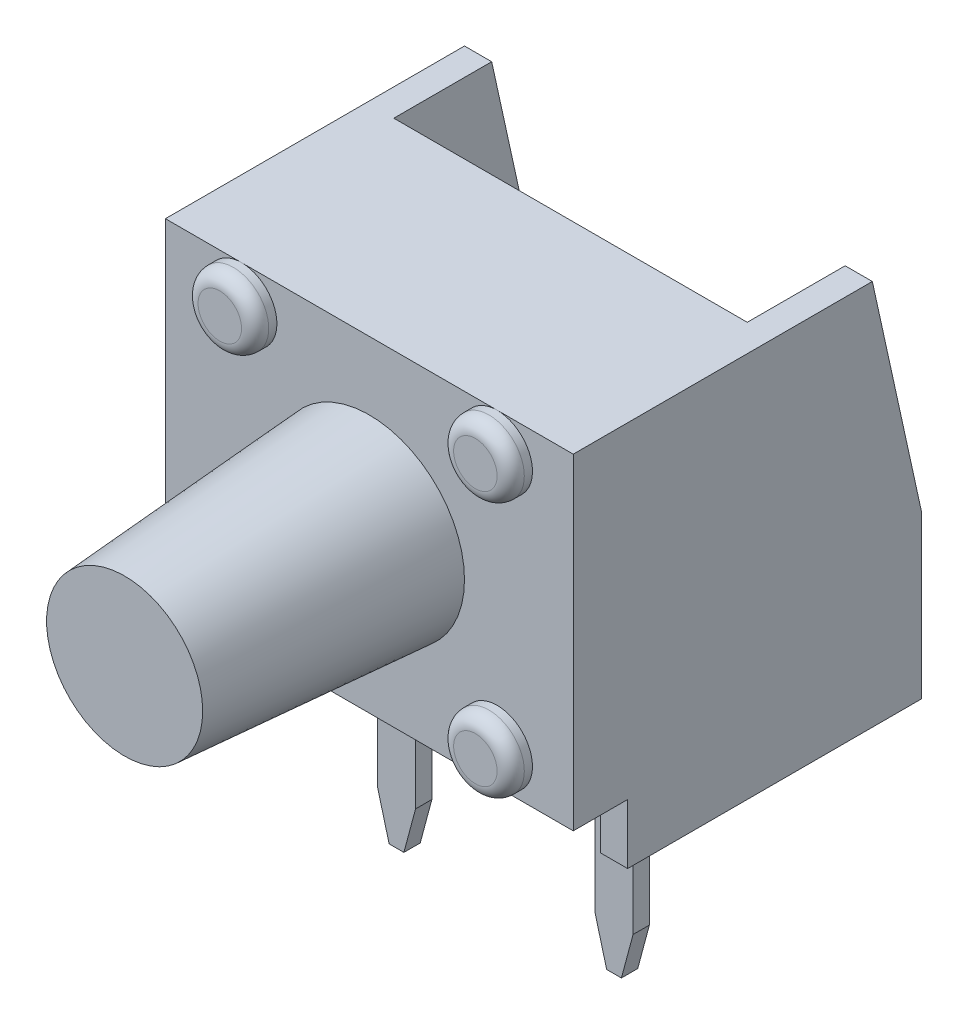
from build123d import *
from OCP.BRepFilletAPI import BRepFilletAPI_MakeChamfer

# Parameters (mm, degrees)
SKETCH1_W           = 7.5
SKETCH1_H           = 3.7
BOSS_EXTRUDE1_DEPTH = 6
SKETCH2_R           = 1.75
BOSS_EXTRUDE2_DEPTH = 4.5
BOSS_EXTRUDE2_TAPER = 4
SKETCH3_W           = 0.7
SKETCH3_H           = 0.3
BOSS_EXTRUDE3_DEPTH = 4.4
SKETCH4_W           = 0.5
SKETCH4_H           = 2.7
BOSS_EXTRUDE4_DEPTH = 1.1
BOSS_EXTRUDE5_DEPTH = 2.7
CUT_EXTRUDE1_DEPTH  = 12.541663658
SKETCH7_R           = 0.65
BOSS_EXTRUDE6_DEPTH = 0.4
FILLET1_R           = 0.25
CHAMFER1_SIZE       = 0.8
CHAMFER1_SIZE2      = 0.214359354


with BuildPart() as part:
    # Sketch1 → Boss-Extrude1 (new body)
    with BuildSketch(Plane(origin=(0, 0, 0), x_dir=(1, 0, 0), z_dir=(0, 1, 0))):
        with Locations((3.75, 1.85)):
            Rectangle(SKETCH1_W, SKETCH1_H)
    extrude(amount=BOSS_EXTRUDE1_DEPTH)

    # Sketch2 → Boss-Extrude2 (add)
    with BuildSketch(Plane.XY):
        with Locations((3.75, 3)):
            Circle(SKETCH2_R)
    extrude(amount=BOSS_EXTRUDE2_DEPTH, taper=BOSS_EXTRUDE2_TAPER)

    # Sketch3 → Boss-Extrude3 (add)
    with BuildSketch(Plane.XZ):
        with Locations((1.75, -2.65)):
            Rectangle(SKETCH3_W, SKETCH3_H)
        with Locations((5.75, -2.65)):
            Rectangle(SKETCH3_W, SKETCH3_H)
    extrude(amount=BOSS_EXTRUDE3_DEPTH)

    # Sketch4 → Boss-Extrude4 (add)
    with BuildSketch(Plane.XZ):
        with Locations((0.25, -2.35)):
            Rectangle(SKETCH4_W, SKETCH4_H)
        with Locations((7.25, -2.35)):
            Rectangle(SKETCH4_W, SKETCH4_H)
    extrude(amount=BOSS_EXTRUDE4_DEPTH)

    # Sketch5 → Boss-Extrude5 (add)
    with BuildSketch(Plane(origin=(0, 0, -3.7), x_dir=(-1, 0, 0), z_dir=(0, 0, -1))):
        Polygon((-7, 0), (-7, 6), (-7.5, 6), (-7.5, -1.1), (-7, -1.1), align=None)
        Polygon((-0.5, -1.1), (-0.5, 0), (-0.5, 6), (0, 6), (0, -1.1), align=None)
    extrude(amount=BOSS_EXTRUDE5_DEPTH)

    # Sketch6 → Cut-Extrude1 (cut, through all)
    with BuildSketch(Plane(origin=(7.5, 0, 0), x_dir=(0, 0, -1), z_dir=(1, 0, 0))):
        Polygon((5.5, 6), (6.4, 1.9), (6.4, 6), align=None)
    extrude(amount=-CUT_EXTRUDE1_DEPTH, mode=Mode.SUBTRACT)

    # Sketch7 → Boss-Extrude6 (add)
    with BuildSketch(Plane.XY):
        with Locations(Location((1.4, 5.35, 0), (0, 0, 90))):
            Circle(SKETCH7_R)
        with Locations(Location((6.1, 5.35, 0), (0, 0, 90))):
            Circle(SKETCH7_R)
        with Locations(Location((6.1, 0.65, 0), (0, 0, 270))):
            Circle(SKETCH7_R)
        with Locations(Location((1.4, 0.65, 0), (0, 0, 270))):
            Circle(SKETCH7_R)
    extrude(amount=BOSS_EXTRUDE6_DEPTH)

    # Fillet1
    fillet1_edges = [part.edges().sort_by_distance(p)[0] for p in [
        (1.4, 4.7, 0.4),
        (6.1, 4.7, 0.4),
        (6.1, 1.3, 0.4),
        (1.4, 1.3, 0.4),
    ]]
    fillet(fillet1_edges, radius=FILLET1_R)

    # Chamfer1: one chamfer whose edges measure the first distance from different faces: ONE call of the kernel's chamfer builder (chamfer() names one face for all edges)
    chamfer1_edges_1 = [part.edges().sort_by_distance(p)[0] for p in [
        (1.4, -4.4, -2.65),
    ]]
    chamfer1_side_1 = [part.faces().sort_by_distance(p)[0] for p in [
        (1.4, -2.2, -2.65),
    ]]
    chamfer1_edges_2 = [part.edges().sort_by_distance(p)[0] for p in [
        (2.1, -4.4, -2.65),
    ]]
    chamfer1_side_2 = [part.faces().sort_by_distance(p)[0] for p in [
        (2.1, -2.2, -2.65),
    ]]
    chamfer1_edges_3 = [part.edges().sort_by_distance(p)[0] for p in [
        (5.4, -4.4, -2.65),
    ]]
    chamfer1_side_3 = [part.faces().sort_by_distance(p)[0] for p in [
        (5.4, -2.2, -2.65),
    ]]
    chamfer1_edges_4 = [part.edges().sort_by_distance(p)[0] for p in [
        (6.1, -4.4, -2.65),
    ]]
    chamfer1_side_4 = [part.faces().sort_by_distance(p)[0] for p in [
        (6.1, -2.2, -2.65),
    ]]
    chamfer1 = BRepFilletAPI_MakeChamfer(part.part.solid().wrapped)
    for e in chamfer1_edges_1:
        chamfer1.Add(CHAMFER1_SIZE, CHAMFER1_SIZE2, e.wrapped, chamfer1_side_1[0].wrapped)  # the first distance lies on this face
    for e in chamfer1_edges_2:
        chamfer1.Add(CHAMFER1_SIZE, CHAMFER1_SIZE2, e.wrapped, chamfer1_side_2[0].wrapped)  # the first distance lies on this face
    for e in chamfer1_edges_3:
        chamfer1.Add(CHAMFER1_SIZE, CHAMFER1_SIZE2, e.wrapped, chamfer1_side_3[0].wrapped)  # the first distance lies on this face
    for e in chamfer1_edges_4:
        chamfer1.Add(CHAMFER1_SIZE, CHAMFER1_SIZE2, e.wrapped, chamfer1_side_4[0].wrapped)  # the first distance lies on this face
    add(Compound.cast(chamfer1.Shape()), mode=Mode.REPLACE)


solid = part.part
